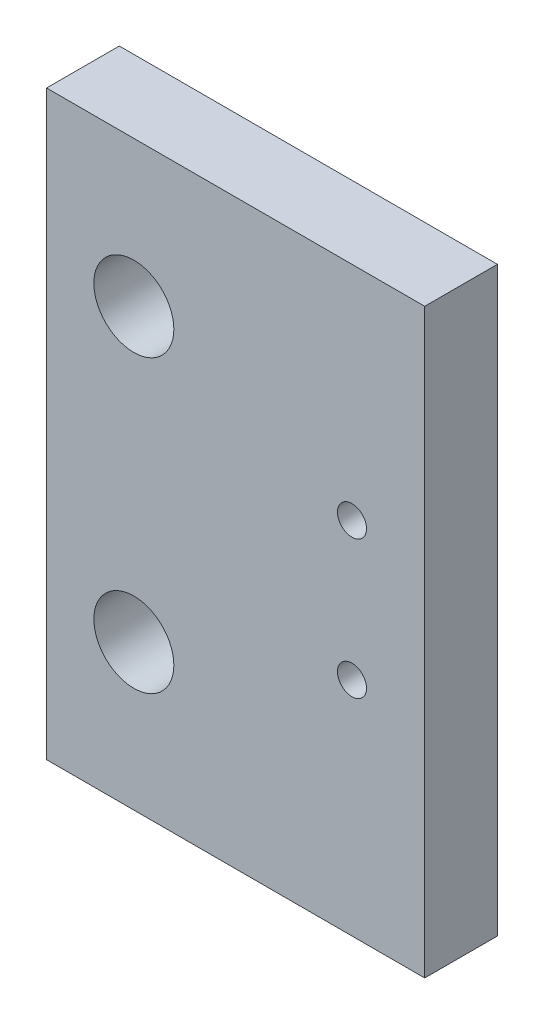
from build123d import *

# Parameters (mm, degrees)
ESQUISSE1_W        = 26
ESQUISSE1_H        = 40
ESQUISSE1_R        = 2.75
ESQUISSE1_R_2      = 1
BOSS_EXTRU_1_DEPTH = 5


with BuildPart() as part:
    # Esquisse1 → Boss.-Extru.1 (new body)
    with BuildSketch(Plane.XY):
        with Locations((-31.603233305, 3.379204029)):
            Rectangle(ESQUISSE1_W, ESQUISSE1_H)
        with Locations((-38.603233305, 13.379204029)):
            Circle(ESQUISSE1_R, mode=Mode.SUBTRACT)
        with Locations((-38.603233305, -6.620795971)):
            Circle(ESQUISSE1_R, mode=Mode.SUBTRACT)
        with Locations((-23.603233305, 8.129204029)):
            Circle(ESQUISSE1_R_2, mode=Mode.SUBTRACT)
        with Locations((-23.603233305, -1.370795971)):
            Circle(ESQUISSE1_R_2, mode=Mode.SUBTRACT)
    extrude(amount=BOSS_EXTRU_1_DEPTH)


solid = part.part
